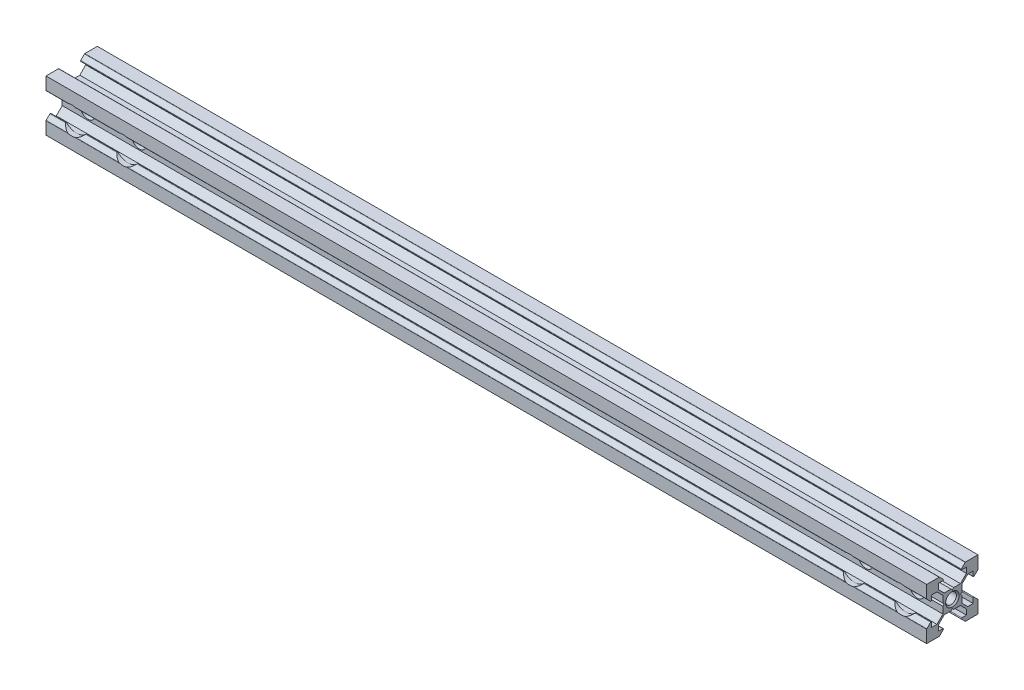
from build123d import *

# Parameters (mm, degrees)
MAIN_BODY_DEPTH                = 163
MAIN_BODY_DEPTH_BACK           = 163
SKETCH2_R                      = 2
CHAMFER1_SIZE                  = 0.5
CHAMFER2_SIZE                  = 0.5
CUT_EXTRUDE1_DEPTH             = 164.552647777
CUT_EXTRUDE1_DEPTH_BACK        = 164.552647777
SKETCH4_R                      = 2.65
CUT_EXTRUDE2_REACH             = 166.378
SKETCH5_R                      = 5
CUT_EXTRUDE2_DIRECTION_2_DEPTH = 165.378135673


with BuildPart() as part:
    # Sketch2 → Main Body (new, two sides: drawn at the far end of the back side and taken through both)
    with BuildSketch(Plane(origin=(0, 0, 0), x_dir=(0, 0, -1), z_dir=(1, 0, 0)).offset(-MAIN_BODY_DEPTH_BACK)):
        with BuildLine():
            Line((0, 3), (-0.5, 3.5))
            Line((-0.5, 3.5), (-3.01, 3.5))
            Line((-3.01, 3.5), (-5.209102089, 5.699102089))
            Line((-5.209102089, 5.699102089), (-5.209102089, 7.699102089))
            Line((-5.209102089, 7.699102089), (-3.479102089, 7.699102089))
            ThreePointArc((-3.479102089, 7.699102089), (-3.294326183, 7.822565403), (-3.337680733, 8.040523446))
            Line((-3.337680733, 8.040523446), (-4.73775216, 9.440594872))
            ThreePointArc((-4.73775216, 9.440594872), (-4.80263683, 9.483949423), (-4.879173516, 9.499173516))
            Line((-4.879173516, 9.499173516), (-9.499173516, 9.499173516))
            Line((-9.499173516, 9.499173516), (-9.499173516, 4.879173516))
            ThreePointArc((-9.499173516, 4.879173516), (-9.483949423, 4.80263683), (-9.440594872, 4.73775216))
            Line((-9.440594872, 4.73775216), (-8.040523446, 3.337680733))
            ThreePointArc((-8.040523446, 3.337680733), (-7.822565403, 3.294326183), (-7.699102089, 3.479102089))
            Line((-7.699102089, 3.479102089), (-7.699102089, 5.209102089))
            Line((-7.699102089, 5.209102089), (-5.699102089, 5.209102089))
            Line((-5.699102089, 5.209102089), (-3.5, 3.01))
            Line((-3.5, 3.01), (-3.5, 0.5))
            Line((-3.5, 0.5), (-3, 0))
            Line((-3, 0), (-3.5, -0.5))
            Line((-3.5, -0.5), (-3.5, -3.01))
            Line((-3.5, -3.01), (-5.699102089, -5.209102089))
            Line((-5.699102089, -5.209102089), (-7.699102089, -5.209102089))
            Line((-7.699102089, -5.209102089), (-7.699102089, -3.479102089))
            ThreePointArc((-7.699102089, -3.479102089), (-7.822565403, -3.294326183), (-8.040523446, -3.337680733))
            Line((-8.040523446, -3.337680733), (-9.440594872, -4.73775216))
            ThreePointArc((-9.440594872, -4.73775216), (-9.483949423, -4.80263683), (-9.499173516, -4.879173516))
            Line((-9.499173516, -4.879173516), (-9.499173516, -9.499173516))
            Line((-9.499173516, -9.499173516), (-4.879173516, -9.499173516))
            ThreePointArc((-4.879173516, -9.499173516), (-4.80263683, -9.483949423), (-4.73775216, -9.440594872))
            Line((-4.73775216, -9.440594872), (-3.337680733, -8.040523446))
            ThreePointArc((-3.337680733, -8.040523446), (-3.294326183, -7.822565403), (-3.479102089, -7.699102089))
            Line((-3.479102089, -7.699102089), (-5.209102089, -7.699102089))
            Line((-5.209102089, -7.699102089), (-5.209102089, -5.699102089))
            Line((-5.209102089, -5.699102089), (-3.01, -3.5))
            Line((-3.01, -3.5), (-0.5, -3.5))
            Line((-0.5, -3.5), (0, -3))
            Line((0, -3), (0.5, -3.5))
            Line((0.5, -3.5), (3.01, -3.5))
            Line((3.01, -3.5), (5.209102089, -5.699102089))
            Line((5.209102089, -5.699102089), (5.209102089, -7.699102089))
            Line((5.209102089, -7.699102089), (3.479102089, -7.699102089))
            ThreePointArc((3.479102089, -7.699102089), (3.294326183, -7.822565403), (3.337680733, -8.040523446))
            Line((3.337680733, -8.040523446), (4.73775216, -9.440594872))
            ThreePointArc((4.73775216, -9.440594872), (4.80263683, -9.483949423), (4.879173516, -9.499173516))
            Line((4.879173516, -9.499173516), (9.499173516, -9.499173516))
            Line((9.499173516, -9.499173516), (9.499173516, -4.879173516))
            ThreePointArc((9.499173516, -4.879173516), (9.483949423, -4.80263683), (9.440594872, -4.73775216))
            Line((9.440594872, -4.73775216), (8.040523446, -3.337680733))
            ThreePointArc((8.040523446, -3.337680733), (7.822565403, -3.294326183), (7.699102089, -3.479102089))
            Line((7.699102089, -3.479102089), (7.699102089, -5.209102089))
            Line((7.699102089, -5.209102089), (5.699102089, -5.209102089))
            Line((5.699102089, -5.209102089), (3.5, -3.01))
            Line((3.5, -3.01), (3.5, -0.5))
            Line((3.5, -0.5), (3, 0))
            Line((3, 0), (3.5, 0.5))
            Line((3.5, 0.5), (3.5, 3.01))
            Line((3.5, 3.01), (5.699102089, 5.209102089))
            Line((5.699102089, 5.209102089), (7.699102089, 5.209102089))
            Line((7.699102089, 5.209102089), (7.699102089, 3.479102089))
            ThreePointArc((7.699102089, 3.479102089), (7.822565403, 3.294326183), (8.040523446, 3.337680733))
            Line((8.040523446, 3.337680733), (9.440594872, 4.73775216))
            ThreePointArc((9.440594872, 4.73775216), (9.483949423, 4.80263683), (9.499173516, 4.879173516))
            Line((9.499173516, 4.879173516), (9.499173516, 9.499173516))
            Line((9.499173516, 9.499173516), (4.879173516, 9.499173516))
            ThreePointArc((4.879173516, 9.499173516), (4.80263683, 9.483949423), (4.73775216, 9.440594872))
            Line((4.73775216, 9.440594872), (3.337680733, 8.040523446))
            ThreePointArc((3.337680733, 8.040523446), (3.294326183, 7.822565403), (3.479102089, 7.699102089))
            Line((3.479102089, 7.699102089), (5.209102089, 7.699102089))
            Line((5.209102089, 7.699102089), (5.209102089, 5.699102089))
            Line((5.209102089, 5.699102089), (3.01, 3.5))
            Line((3.01, 3.5), (0.5, 3.5))
            Line((0.5, 3.5), (0, 3))
        make_face()
        Circle(SKETCH2_R, mode=Mode.SUBTRACT)
    extrude(amount=MAIN_BODY_DEPTH + MAIN_BODY_DEPTH_BACK)

    # Chamfer1
    chamfer1_edges = [part.edges().sort_by_distance(p)[0] for p in [
        (163, 0, 2),
    ]]
    chamfer(chamfer1_edges, length=CHAMFER1_SIZE)

    # Chamfer2
    chamfer2_edges = [part.edges().sort_by_distance(p)[0] for p in [
        (-163, 0, 2),
    ]]
    chamfer(chamfer2_edges, length=CHAMFER2_SIZE)

    # Sketch4 → Cut-Extrude1 (cut, two sides: drawn at the far end of the back side and taken through both)
    with BuildSketch(Plane.XY.offset(-CUT_EXTRUDE1_DEPTH_BACK)):
        with Locations((-153.5, 0)):
            Circle(SKETCH4_R)
        with Locations((-134.5, 0)):
            Circle(SKETCH4_R)
        with Locations((153.5, 0)):
            Circle(SKETCH4_R)
        with Locations((134.5, 0)):
            Circle(SKETCH4_R)
    extrude(amount=CUT_EXTRUDE1_DEPTH + CUT_EXTRUDE1_DEPTH_BACK, mode=Mode.SUBTRACT)

    # Cut-Extrude2: up to this face of the body (flat: up to its plane)
    cut_extrude2_end = Plane(part.part.faces().sort_by_distance((0, 4.344102089, 7.699102089))[0])
    # Sketch5 → Cut-Extrude2 (cut, up to the picked face)
    with BuildSketch(Plane.XY.offset(9.499173516), mode=Mode.PRIVATE) as cut_extrude2_sk1:
        with Locations((-153.5, 0)):
            Circle(SKETCH5_R)
    cut_extrude2_tool1 = split(extrude(cut_extrude2_sk1.sketch, amount=-CUT_EXTRUDE2_REACH, mode=Mode.PRIVATE), bisect_by=cut_extrude2_end, keep=Keep.BOTH, mode=Mode.PRIVATE)
    # Sketch5 → Cut-Extrude2 (cut, up to the picked face)
    with BuildSketch(Plane.XY.offset(9.499173516), mode=Mode.PRIVATE) as cut_extrude2_sk2:
        with Locations((-134.5, 0)):
            Circle(SKETCH5_R)
    cut_extrude2_tool2 = split(extrude(cut_extrude2_sk2.sketch, amount=-CUT_EXTRUDE2_REACH, mode=Mode.PRIVATE), bisect_by=cut_extrude2_end, keep=Keep.BOTH, mode=Mode.PRIVATE)
    # Sketch5 → Cut-Extrude2 (cut, up to the picked face)
    with BuildSketch(Plane.XY.offset(9.499173516), mode=Mode.PRIVATE) as cut_extrude2_sk3:
        with Locations((134.5, 0)):
            Circle(SKETCH5_R)
    cut_extrude2_tool3 = split(extrude(cut_extrude2_sk3.sketch, amount=-CUT_EXTRUDE2_REACH, mode=Mode.PRIVATE), bisect_by=cut_extrude2_end, keep=Keep.BOTH, mode=Mode.PRIVATE)
    # Sketch5 → Cut-Extrude2 (cut, up to the picked face)
    with BuildSketch(Plane.XY.offset(9.499173516), mode=Mode.PRIVATE) as cut_extrude2_sk4:
        with Locations((153.5, 0)):
            Circle(SKETCH5_R)
    cut_extrude2_tool4 = split(extrude(cut_extrude2_sk4.sketch, amount=-CUT_EXTRUDE2_REACH, mode=Mode.PRIVATE), bisect_by=cut_extrude2_end, keep=Keep.BOTH, mode=Mode.PRIVATE)
    add(cut_extrude2_tool1.solids().sort_by(Axis((-153.5, 0, 9.499174), (0, 0, -1)))[0], mode=Mode.SUBTRACT)
    add(cut_extrude2_tool2.solids().sort_by(Axis((-134.5, 0, 9.499174), (0, 0, -1)))[0], mode=Mode.SUBTRACT)
    add(cut_extrude2_tool3.solids().sort_by(Axis((134.5, 0, 9.499174), (0, 0, -1)))[0], mode=Mode.SUBTRACT)
    add(cut_extrude2_tool4.solids().sort_by(Axis((153.5, 0, 9.499174), (0, 0, -1)))[0], mode=Mode.SUBTRACT)

    # Sketch5 → Cut-Extrude2 direction 2 (cut)
    with BuildSketch(Plane.XY.offset(9.499173516)):
        with Locations((-153.5, 0)):
            Circle(SKETCH5_R)
        with Locations((-134.5, 0)):
            Circle(SKETCH5_R)
        with Locations((134.5, 0)):
            Circle(SKETCH5_R)
        with Locations((153.5, 0)):
            Circle(SKETCH5_R)
    extrude(amount=CUT_EXTRUDE2_DIRECTION_2_DEPTH, mode=Mode.SUBTRACT)


solid = part.part
